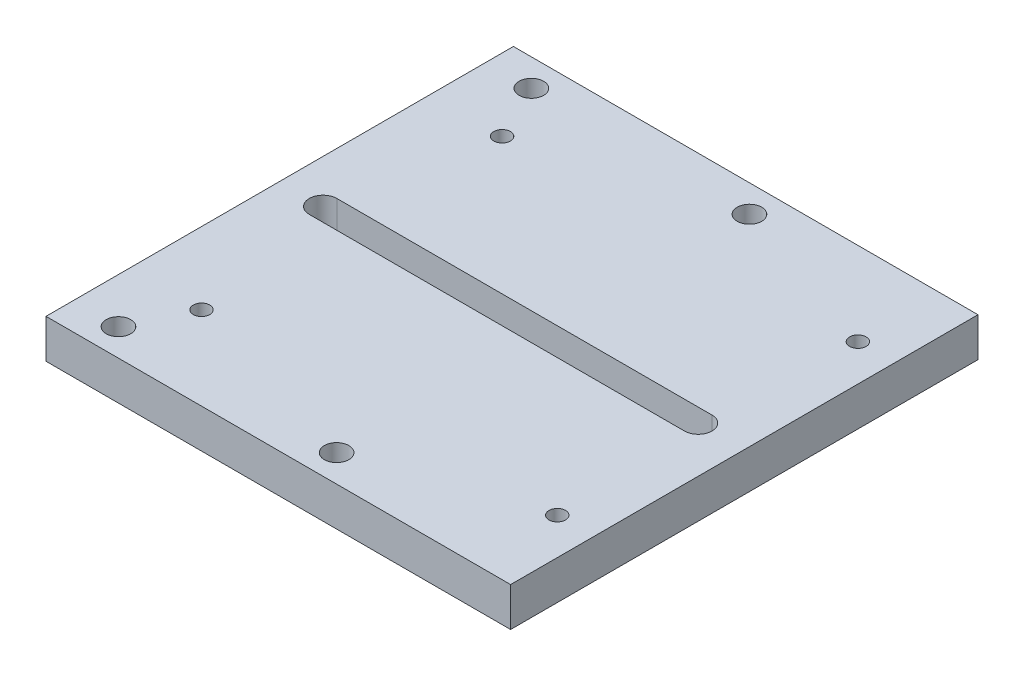
from build123d import *

# Parameters (mm, degrees)
SKETCH1_W           = 75.74480754
SKETCH1_H           = 76.2
SKETCH1_R           = 1.35
SKETCH1_R_2         = 1.999869
BOSS_EXTRUDE1_DEPTH = 6.35


with BuildPart() as part:
    # Sketch1 → Boss-Extrude1 (new body)
    with BuildSketch(Plane(origin=(0, 0, 0), x_dir=(1, 0, 0), z_dir=(0, 1, 0))):
        with Locations((-2.885014868, 0)):
            Rectangle(SKETCH1_W, SKETCH1_H)
        with Locations((-29, -24.5)):
            Circle(SKETCH1_R, mode=Mode.SUBTRACT)
        with Locations((29, -24.5)):
            Circle(SKETCH1_R, mode=Mode.SUBTRACT)
        with Locations((-29, 24.5)):
            Circle(SKETCH1_R, mode=Mode.SUBTRACT)
        with Locations((29, 24.5)):
            Circle(SKETCH1_R, mode=Mode.SUBTRACT)
        with Locations((-33.386335012, 33.655)):
            Circle(SKETCH1_R_2, mode=Mode.SUBTRACT)
        with Locations((-33.386335012, -33.655)):
            Circle(SKETCH1_R_2, mode=Mode.SUBTRACT)
        with Locations((2.173664988, 33.655)):
            Circle(SKETCH1_R_2, mode=Mode.SUBTRACT)
        with Locations((2.173664988, -33.655)):
            Circle(SKETCH1_R_2, mode=Mode.SUBTRACT)
        with BuildLine():
            Line((-33.68784786, 2.25), (27.48047437, 2.25))
            ThreePointArc((27.48047437, 2.25), (29.73047437, 0), (27.48047437, -2.25))
            Line((27.48047437, -2.25), (-33.68784786, -2.25))
            ThreePointArc((-33.68784786, -2.25), (-35.93784786, 0), (-33.68784786, 2.25))
        make_face(mode=Mode.SUBTRACT)
    extrude(amount=BOSS_EXTRUDE1_DEPTH)


solid = part.part
